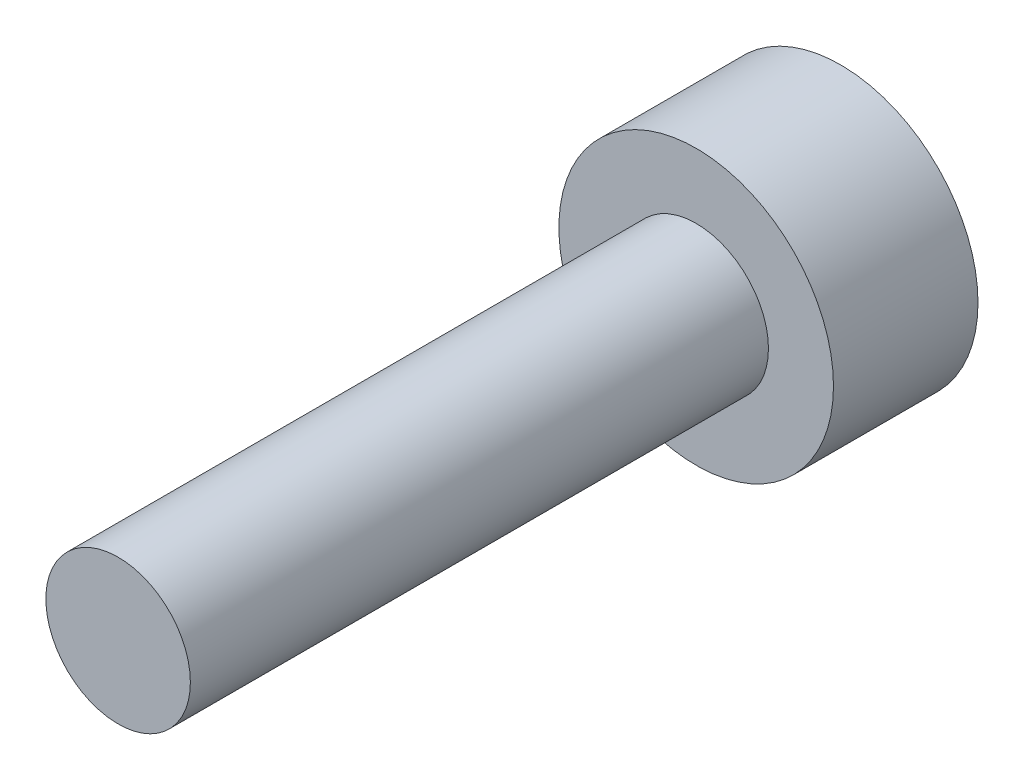
from build123d import *

# Parameters (mm, degrees)
HEAD_ENVELOPE_START         = -2
SKETCH1_R                   = 1.9
HEAD_ENVELOPE_DEPTH         = 2
SKETCH2_R                   = 1
THREAD_MAJOR_ENVELOPE_DEPTH = 8


with BuildPart() as part:
    # Sketch1 → Head_Envelope (new body)
    with BuildSketch(Plane.XY.offset(HEAD_ENVELOPE_START)):
        Circle(SKETCH1_R)
    extrude(amount=HEAD_ENVELOPE_DEPTH)

    # Sketch2 → Thread_Major_Envelope (add)
    with BuildSketch(Plane.XY):
        Circle(SKETCH2_R)
    extrude(amount=THREAD_MAJOR_ENVELOPE_DEPTH)


solid = part.part
